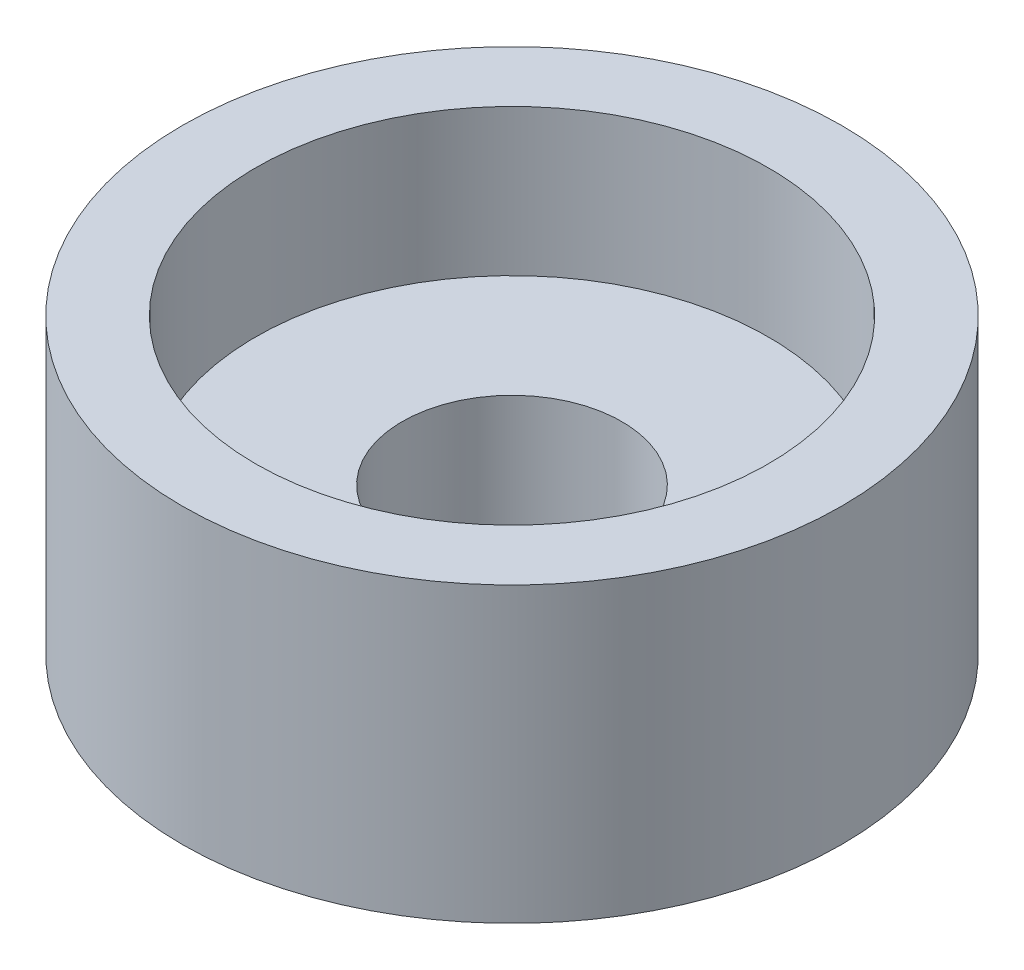
from build123d import *

# Parameters (mm, degrees)
SKETCH_1_R          = 4.5
EXTRUDE_1_DEPTH     = 2
SKETCH_2_R          = 3.5
CUT_EXTRUDE_1_DEPTH = 2
SKETCH_3_R          = 1.5
CUT_EXTRUDE_2_DEPTH = 7.670832032


with BuildPart() as part:
    # 草图1 → 凸台-拉伸1 (new, symmetric)
    with BuildSketch(Plane(origin=(0, 0, 0), x_dir=(1, 0, 0), z_dir=(0, 1, 0))):
        with Locations(Location((0, 0, 0), (0, 0, 270))):
            Circle(SKETCH_1_R)
    extrude(amount=EXTRUDE_1_DEPTH, both=True)

    # 草图2 → 切除-拉伸1 (cut)
    with BuildSketch(Plane(origin=(0, 2, 0), x_dir=(1, 0, 0), z_dir=(0, 1, 0))):
        with Locations(Location((0, 0, 0), (0, 0, 270))):
            Circle(SKETCH_2_R)
    extrude(amount=-CUT_EXTRUDE_1_DEPTH, mode=Mode.SUBTRACT)

    # 草图3 → 切除-拉伸2 (cut, through all)
    with BuildSketch(Plane(origin=(0, 0, 0), x_dir=(1, 0, 0), z_dir=(0, 1, 0))):
        with Locations(Location((0, 0, 0), (0, 0, 270))):
            Circle(SKETCH_3_R)
    extrude(amount=-CUT_EXTRUDE_2_DEPTH, mode=Mode.SUBTRACT)


solid = part.part
